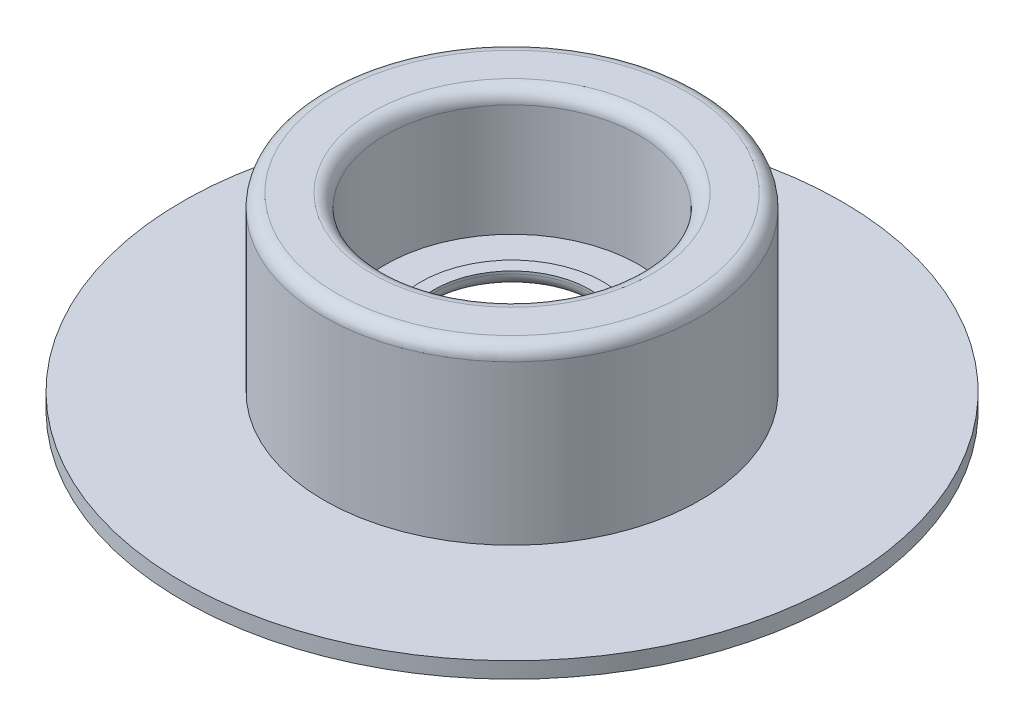
from build123d import *

# Parameters (mm, degrees)
FILLET1_R = 0.254


with BuildPart() as part:
    # Sketch1 → Revolve1 (revolve)
    with BuildSketch(Plane.XY, mode=Mode.PRIVATE) as revolve1_sk:
        Polygon((-6.2738, 0), (-3.175, 0), (-3.175, 3.2766), (-2.8702, 3.2766), (-2.8702, 0.9398), (-1.4859, 0.9398), (-1.4859, 1.2446), (-1.7399, 1.2446), (-1.7399, 1.1938), (-2.413, 1.1938), (-2.413, 3.5814), (-3.5814, 3.5814), (-3.5814, 0.3048), (-6.2738, 0.3048), align=None)
    revolve(revolve1_sk.sketch.rotate(Axis((0, 0, 0), (0, 1, 0)), 270), axis=Axis((0, 0, 0), (0, 1, 0)))

    # Fillet1
    fillet1_edges = [part.edges().sort_by_distance(p)[0] for p in [
        (0, 0.9398, 2.8702),
        (0, 0.9398, 1.4859),
        (0, 3.5814, 2.413),
        (0, 3.5814, 3.5814),
        (0, 0, 3.175),
    ]]
    fillet(fillet1_edges, radius=FILLET1_R)


solid = part.part
